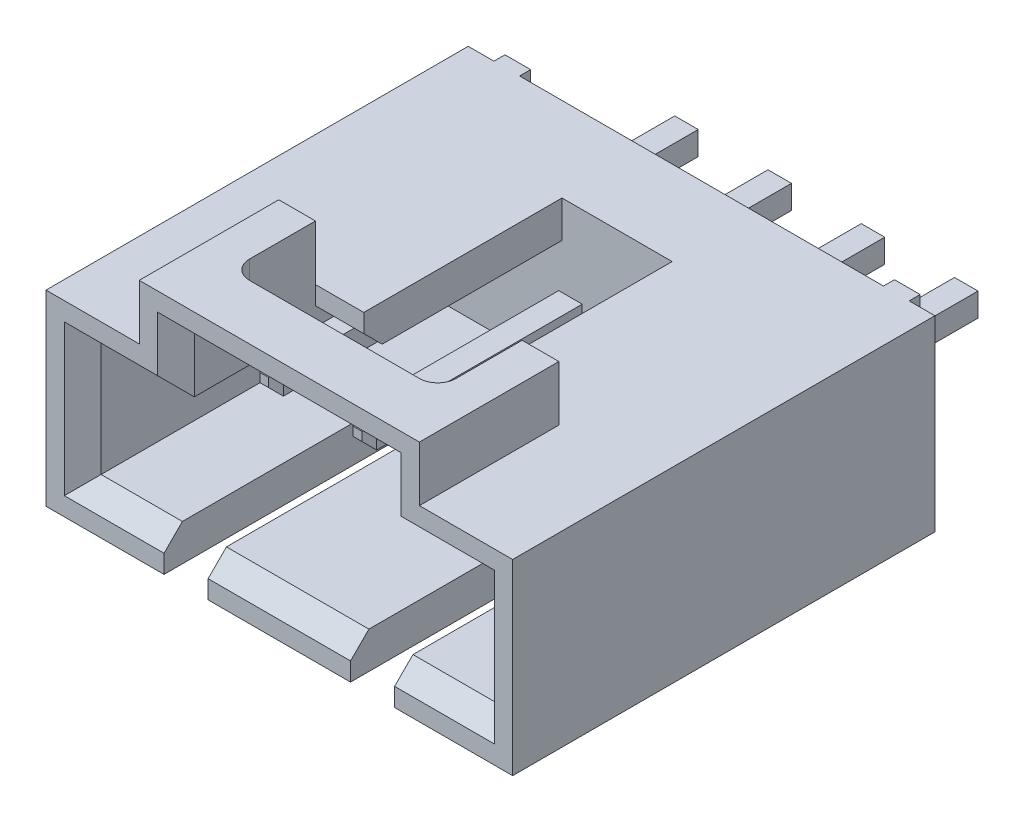
from build123d import *

# Parameters (mm, degrees)
EXTRUDE_1_DEPTH                    = 2.55
CUT_EXTRUDE_1_DEPTH                = 9.2
EXTRUDE_2_DEPTH                    = 3.8
SKETCH_4_W                         = 5.63
SKETCH_4_H                         = 1
CUT_EXTRUDE_2_DEPTH                = 3.8
CUT_EXTRUDE_3_REACH                = 16.939
CHAMFER_1_SIZE                     = 0.5
EXTRUDE_START                      = -3.6
SKETCH_6_W                         = 0.64
SKETCH_6_H                         = 0.64
EXTRUDE_3_DEPTH                    = 11.7
CHAMFER_2_SIZE                     = 0.2
PATTERN_LINEAR_1_COUNT             = 4
PATTERN_LINEAR_1_PITCH             = 2.54
CHAMFER_2_OF_PATTERN_LINEAR_1_SIZE = 0.2


with BuildPart() as part:
    # Эскиз1 → Бобышка-Вытянуть1 (new, symmetric)
    with BuildSketch(Plane(origin=(0, 0, 0), x_dir=(1, 0, 0), z_dir=(0, 1, 0))):
        Polygon((-4.955, -0.3), (4.955, -0.3), (4.955, 0), (5.655, 0), (5.655, -0.3), (6.355, -0.3), (6.355, -11.8), (-6.355, -11.8), (-6.355, -0.3), (-5.655, -0.3), (-5.655, 0), (-4.955, 0), align=None)
    extrude(amount=EXTRUDE_1_DEPTH, both=True)

    # Эскиз2 → Вырез-Вытянуть1 (cut)
    with BuildSketch(Plane.XY.offset(11.8)):
        Polygon((-5.355, 1.55), (-5.355, -1.55), (-3.14, -1.55), (-3.14, -2.55), (-1.94, -2.55), (-1.94, -1.55), (1.94, -1.55), (1.94, -2.55), (3.14, -2.55), (3.14, -1.55), (5.355, -1.55), (5.355, 1.55), (1.5, 1.55), (1.5, 2.55), (-1.5, 2.55), (-1.5, 1.55), align=None)
    extrude(amount=-CUT_EXTRUDE_1_DEPTH, mode=Mode.SUBTRACT)

    # Эскиз3 → Бобышка-Вытянуть2 (add)
    with BuildSketch(Plane.XY.offset(11.8)):
        Polygon((-3.815, 2.55), (-3.815, 4.05), (3.815, 4.05), (3.815, 2.55), (2.815, 2.55), (2.815, 3.05), (-2.815, 3.05), (-2.815, 2.55), align=None)
    extrude(amount=-EXTRUDE_2_DEPTH)

    # Эскиз4 → Вырез-Вытянуть2 (cut)
    with BuildSketch(Plane.XY.offset(11.8)):
        with Locations((0, 2.05)):
            Rectangle(SKETCH_4_W, SKETCH_4_H)
    extrude(amount=-CUT_EXTRUDE_2_DEPTH, mode=Mode.SUBTRACT)

    # Эскиз5 → Вырез-Вытянуть3 (cut, up to next)
    with BuildSketch(Plane(origin=(0, 4.05, 0), x_dir=(1, 0, 0), z_dir=(0, 1, 0)), mode=Mode.PRIVATE) as cut_extrude_3_sk1:
        with BuildLine():
            Line((2.815, -8), (2.815, -9.8))
            ThreePointArc((2.815, -9.8), (2.668553391, -10.153553391), (2.315, -10.3))
            Line((2.315, -10.3), (-2.315, -10.3))
            ThreePointArc((-2.315, -10.3), (-2.668553391, -10.153553391), (-2.815, -9.8))
            Line((-2.815, -9.8), (-2.815, -8))
            Line((-2.815, -8), (2.815, -8))
        make_face()
    cut_extrude_3_tool1 = extrude(cut_extrude_3_sk1.sketch, amount=-CUT_EXTRUDE_3_REACH, mode=Mode.PRIVATE) & part.part
    add(cut_extrude_3_tool1.solids().sort_by_distance((0, 4.05, 9.141324))[0], mode=Mode.SUBTRACT)

    # Фаска1
    chamfer_1_edges = [part.edges().sort_by_distance(p)[0] for p in [
        (2.1575, 1.55, 8),
        (-4.085, 1.55, 11.8),
        (-2.1575, 1.55, 8),
        (-5.355, 0, 11.8),
        (-4.2475, -1.55, 11.8),
        (0, -1.55, 11.8),
        (4.2475, -1.55, 11.8),
        (5.355, 0, 11.8),
        (4.085, 1.55, 11.8),
        (-2.815, 2.3, 11.8),
        (0, 3.05, 11.8),
        (2.815, 2.3, 11.8),
    ]]
    chamfer(chamfer_1_edges, length=CHAMFER_1_SIZE)

    # Эскиз6 → Бобышка-Вытянуть3 (add)
    with BuildSketch(Plane.XY.offset(0.3).offset(EXTRUDE_START)):
        with Locations((3.81, 0)):
            Rectangle(SKETCH_6_W, SKETCH_6_H)
    extrude_3 = extrude(amount=EXTRUDE_3_DEPTH)

    # Фаска2
    chamfer_2_edges = [part.edges().sort_by_distance(p)[0] for p in [
        (3.81, 0.32, 8.4),
        (4.13, 0, 8.4),
        (3.81, -0.32, 8.4),
        (3.49, 0, 8.4),
        (3.49, 0, -3.3),
        (3.81, 0.32, -3.3),
        (4.13, 0, -3.3),
        (3.81, -0.32, -3.3),
    ]]
    chamfer(chamfer_2_edges, length=CHAMFER_2_SIZE)

    # Линейный массив1: Бобышка-Вытянуть3 ×4
    with Locations(*[(-i * PATTERN_LINEAR_1_PITCH, 0, 0) for i in range(1, PATTERN_LINEAR_1_COUNT)]):
        add(extrude_3)

    # Фаска2 of Линейный массив1
    chamfer_2_of_pattern_linear_1_edges = [part.edges().sort_by_distance(p)[0] for p in [
        (1.27, 0.32, 8.4),
        (1.59, 0, 8.4),
        (1.27, -0.32, 8.4),
        (0.95, 0, 8.4),
        (0.95, 0, -3.3),
        (1.27, 0.32, -3.3),
        (1.59, 0, -3.3),
        (1.27, -0.32, -3.3),
        (-1.27, 0.32, 8.4),
        (-0.95, 0, 8.4),
        (-1.27, -0.32, 8.4),
        (-1.59, 0, 8.4),
        (-1.59, 0, -3.3),
        (-1.27, 0.32, -3.3),
        (-0.95, 0, -3.3),
        (-1.27, -0.32, -3.3),
        (-3.81, 0.32, 8.4),
        (-3.49, 0, 8.4),
        (-3.81, -0.32, 8.4),
        (-4.13, 0, 8.4),
        (-4.13, 0, -3.3),
        (-3.81, 0.32, -3.3),
        (-3.49, 0, -3.3),
        (-3.81, -0.32, -3.3),
    ]]
    chamfer(chamfer_2_of_pattern_linear_1_edges, length=CHAMFER_2_OF_PATTERN_LINEAR_1_SIZE)


solid = part.part
